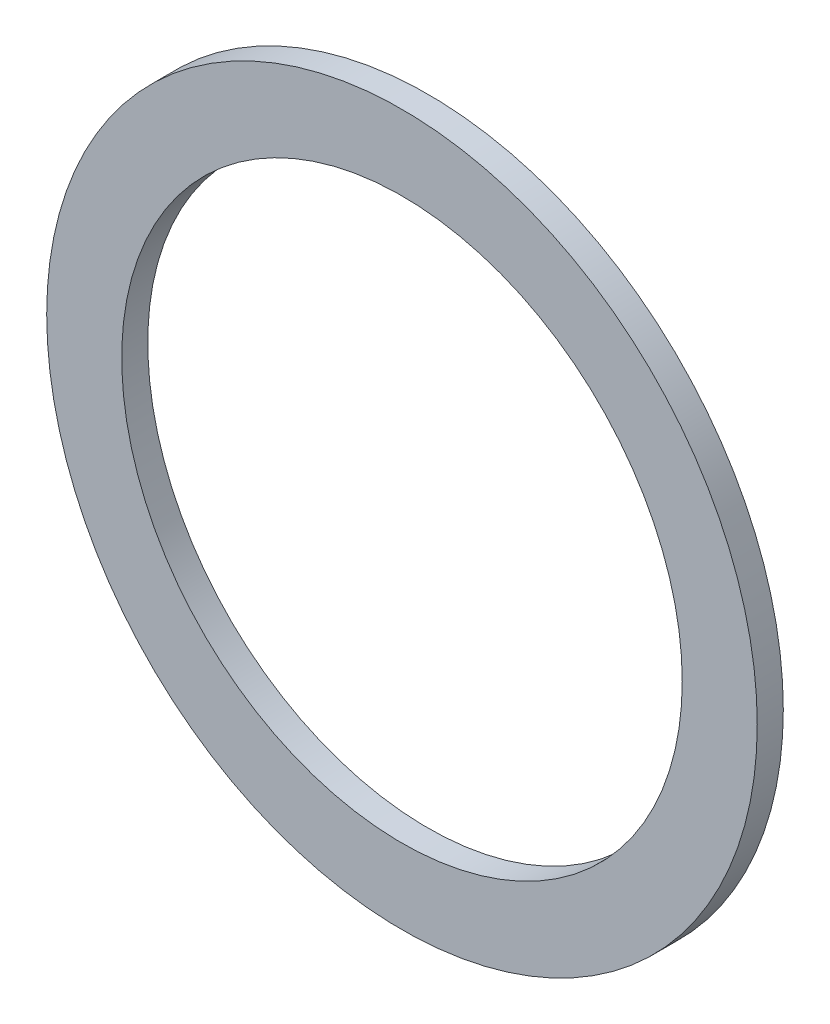
from build123d import *

# Parameters (mm, degrees)
ESQUISSE1_R          = 22.5
ESQUISSE1_R_2        = 17.75
BASE_EXTRUSION_DEPTH = 1.65


with BuildPart() as part:
    # Esquisse1 → Base-Extrusion (new body)
    with BuildSketch(Plane.XY):
        Circle(ESQUISSE1_R)
        Circle(ESQUISSE1_R_2, mode=Mode.SUBTRACT)
    extrude(amount=BASE_EXTRUSION_DEPTH)


solid = part.part
